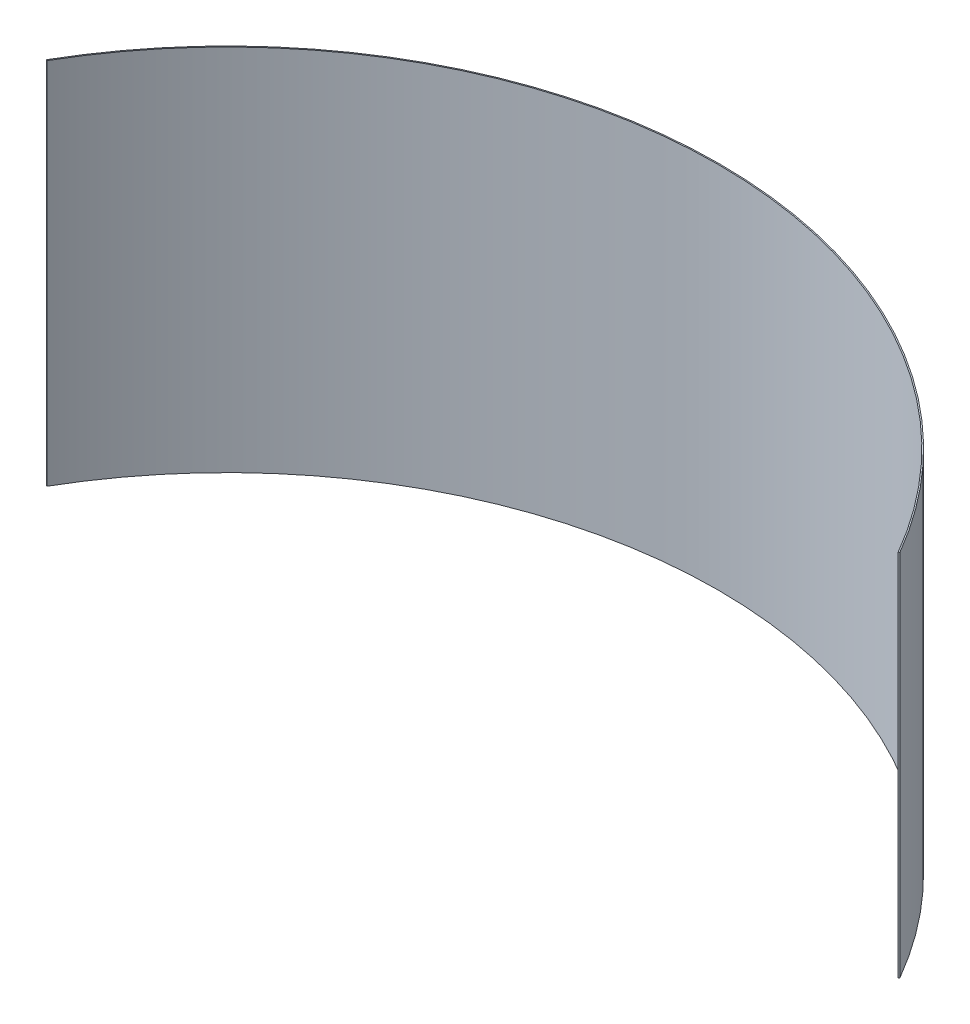
from build123d import *

# Parameters (mm, degrees)
Y_KSEKLIK_EKSTR_ZYON1_DEPTH = 15


with BuildPart() as part:
    # Çizim1 → Yükseklik-Ekstrüzyon1 (new body)
    with BuildSketch(Plane(origin=(0, 0, 0), x_dir=(1, 0, 0), z_dir=(0, 1, 0))):
        with BuildLine():
            Line((17.320508076, 10), (17.363809346, 10.025))
            ThreePointArc((17.363809346, 10.025), (0, 20.05), (-17.363809346, 10.025))
            Line((-17.363809346, 10.025), (-17.320508076, 10))
            ThreePointArc((-17.320508076, 10), (0, 20), (17.320508076, 10))
        make_face()
    extrude(amount=Y_KSEKLIK_EKSTR_ZYON1_DEPTH)


solid = part.part
